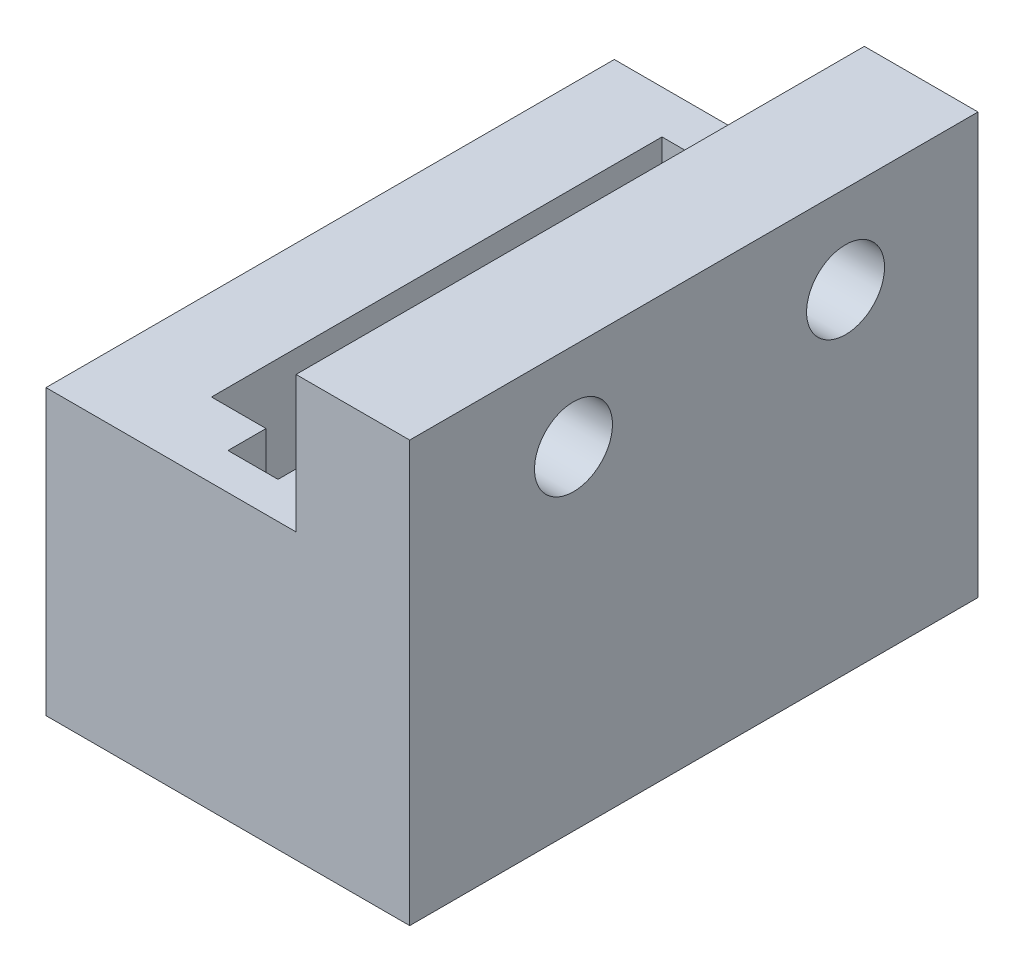
from build123d import *

# Parameters (mm, degrees)
SKETCH1_W           = 16
SKETCH1_H           = 25
BOSS_EXTRUDE1_DEPTH = 12.5
CUT_EXTRUDE1_DEPTH  = 6.056
SKETCH4_W           = 5
SKETCH4_H           = 25
BOSS_EXTRUDE2_DEPTH = 6
SKETCH3_R           = 1.7145
CUT_EXTRUDE2_DEPTH  = 5
SKETCH6_R           = 0.5
CUT_EXTRUDE3_DEPTH  = 4
SKETCH7_R           = 1.5
CUT_EXTRUDE4_DEPTH  = 2


with BuildPart() as part:
    # Sketch1 → Boss-Extrude1 (new body)
    with BuildSketch(Plane(origin=(0, 0, 0), x_dir=(1, 0, 0), z_dir=(0, 1, 0))):
        with Locations((8, 12.5)):
            Rectangle(SKETCH1_W, SKETCH1_H)
    extrude(amount=BOSS_EXTRUDE1_DEPTH)

    # Sketch2 → Cut-Extrude1 (cut)
    with BuildSketch(Plane(origin=(0, 12.5, 0), x_dir=(1, 0, 0), z_dir=(0, 1, 0))):
        Polygon((4, 23.098280204), (6.4, 23.098280204), (6.4, 25), (8.6, 25), (8.6, 23.098280204), (11, 23.098280204), (11, 3.280280204), (8.6, 3.280280204), (8.6, 1.605280204), (6.4, 1.605280204), (6.4, 3.280280204), (4, 3.280280204), align=None)
    extrude(amount=-CUT_EXTRUDE1_DEPTH, mode=Mode.SUBTRACT)

    # Sketch4 → Boss-Extrude2 (add)
    with BuildSketch(Plane(origin=(0, 12.5, 0), x_dir=(1, 0, 0), z_dir=(0, 1, 0))):
        with Locations((13.5, 12.5)):
            Rectangle(SKETCH4_W, SKETCH4_H)
    extrude(amount=BOSS_EXTRUDE2_DEPTH)

    # Sketch3 → Cut-Extrude2 (cut)
    with BuildSketch(Plane(origin=(16, 0, 0), x_dir=(0, 0, -1), z_dir=(1, 0, 0))):
        with Locations((7.205280204, 14.644)):
            Circle(SKETCH3_R)
        with Locations((19.173280204, 14.644)):
            Circle(SKETCH3_R)
    extrude(amount=-CUT_EXTRUDE2_DEPTH, mode=Mode.SUBTRACT)

    # Sketch6 → Cut-Extrude3 (cut)
    with BuildSketch(Plane(origin=(0, 6.444, 0), x_dir=(1, 0, 0), z_dir=(0, 1, 0))):
        with Locations(Location((5.875, 9.605280204, 0), (0, 0, 270))):
            Circle(SKETCH6_R)
        with Locations(Location((9.125, 9.605280204, 0), (0, 0, 270))):
            Circle(SKETCH6_R)
        with Locations(Location((5.875, 17.605280204, 0), (0, 0, 270))):
            Circle(SKETCH6_R)
        with Locations(Location((9.125, 17.605280204, 0), (0, 0, 270))):
            Circle(SKETCH6_R)
    extrude(amount=-CUT_EXTRUDE3_DEPTH, mode=Mode.SUBTRACT)

    # Sketch7 → Cut-Extrude4 (cut)
    with BuildSketch(Plane(origin=(0, 6.444, 0), x_dir=(1, 0, 0), z_dir=(0, 1, 0))):
        with Locations(Location((7.5, 21.605280204, 0), (0, 0, 270))):
            Circle(SKETCH7_R)
        with Locations(Location((7.5, 13.605280204, 0), (0, 0, 270))):
            Circle(SKETCH7_R)
        with Locations(Location((7.5, 5.605280204, 0), (0, 0, 270))):
            Circle(SKETCH7_R)
    extrude(amount=-CUT_EXTRUDE4_DEPTH, mode=Mode.SUBTRACT)


solid = part.part
